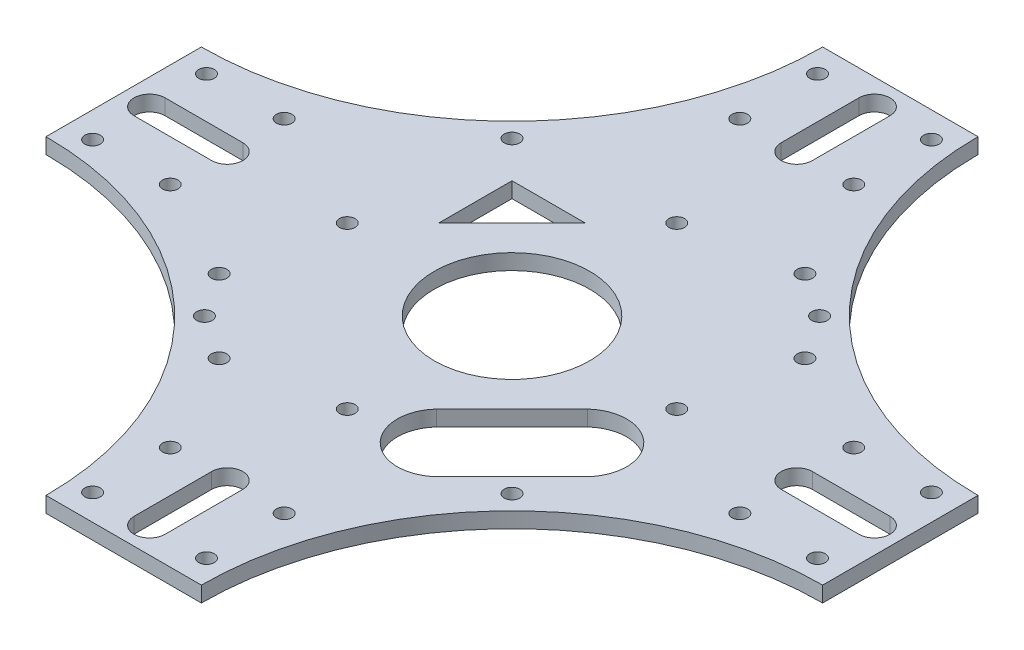
from build123d import *

# Parameters (mm, degrees)
SKETCH_1_R           = 1.25
EXTRUDE_1_DEPTH      = 3
SKETCH_2_R           = 1.5
CUT_EXTRUDE_1_DEPTH  = 3
CUT_EXTRUDE_2_DEPTH  = 3
CUT_EXTRUDE_3_DEPTH  = 3
CUT_EXTRUDE_4_DEPTH  = 10
SKETCH_6_R           = 1.5
CUT_EXTRUDE_5_DEPTH  = 10
SKETCH_7_R           = 1.5
CUT_EXTRUDE_8_DEPTH  = 10
SKETCH_8_R           = 1.5
CUT_EXTRUDE_9_DEPTH  = 10
SKETCH_9_R           = 15
CUT_EXTRUDE_10_DEPTH = 10
SKETCH_10_R          = 1.5
CUT_EXTRUDE_11_DEPTH = 10
CUT_EXTRUDE_12_DEPTH = 10


with BuildPart() as part:
    # 草图1 → 凸台-拉伸1 (new body)
    # profile 1 of 4: a face of its own
    with BuildSketch(Plane(origin=(0, 0, 0), x_dir=(1, 0, 0), z_dir=(0, 1, 0))):
        with BuildLine():
            ThreePointArc((75, -15), (32.573593129, -32.573593129), (15, -75))
            Line((15, -75), (0, -75))
            Line((0, -75), (0, 0))
            Line((0, 0), (75, 0))
            Line((75, 0), (75, -15))
        make_face()
        with Locations(Location((11, -70, 0), (0, 0, 270))):
            Circle(SKETCH_1_R, mode=Mode.SUBTRACT)
        with Locations(Location((70, -11, 0), (0, 0, 270))):
            Circle(SKETCH_1_R, mode=Mode.SUBTRACT)
    # profile 2 of 4: a face of its own
    with BuildSketch(Plane(origin=(0, 0, 0), x_dir=(1, 0, 0), z_dir=(0, 1, 0))):
        with BuildLine():
            ThreePointArc((-15, -75), (-32.573593129, -32.573593129), (-75, -15))
            Line((-75, -15), (-75, 0))
            Line((-75, 0), (0, 0))
            Line((0, 0), (0, -75))
            Line((0, -75), (-15, -75))
        make_face()
        with Locations(Location((-70, -11, 0), (0, 0, 270))):
            Circle(SKETCH_1_R, mode=Mode.SUBTRACT)
        with Locations(Location((-11, -70, 0), (0, 0, 270))):
            Circle(SKETCH_1_R, mode=Mode.SUBTRACT)
    # profile 3 of 4: a face of its own
    with BuildSketch(Plane(origin=(0, 0, 0), x_dir=(1, 0, 0), z_dir=(0, 1, 0))):
        with BuildLine():
            ThreePointArc((-75, 15), (-32.573593129, 32.573593129), (-15, 75))
            Line((-15, 75), (0, 75))
            Line((0, 75), (0, 0))
            Line((0, 0), (-75, 0))
            Line((-75, 0), (-75, 15))
        make_face()
        with Locations(Location((-11, 70, 0), (0, 0, 270))):
            Circle(SKETCH_1_R, mode=Mode.SUBTRACT)
        with Locations(Location((-70, 11, 0), (0, 0, 270))):
            Circle(SKETCH_1_R, mode=Mode.SUBTRACT)
    # profile 4 of 4: a face of its own
    with BuildSketch(Plane(origin=(0, 0, 0), x_dir=(1, 0, 0), z_dir=(0, 1, 0))):
        with BuildLine():
            ThreePointArc((15, 75), (32.573593129, 32.573593129), (75, 15))
            Line((75, 15), (75, 0))
            Line((75, 0), (0, 0))
            Line((0, 0), (0, 75))
            Line((0, 75), (15, 75))
        make_face()
        with Locations(Location((70, 11, 0), (0, 0, 270))):
            Circle(SKETCH_1_R, mode=Mode.SUBTRACT)
        with Locations(Location((11, 70, 0), (0, 0, 270))):
            Circle(SKETCH_1_R, mode=Mode.SUBTRACT)
    extrude(amount=EXTRUDE_1_DEPTH)

    # 草图2 → 切除-拉伸1 (cut)
    with BuildSketch(Plane.XZ):
        with Locations(Location((0.353553391, -31.466251763, 0), (0, 0, 270))):
            Circle(SKETCH_2_R)
        with Locations(Location((31.466251763, -0.353553391, 0), (0, 0, 270))):
            Circle(SKETCH_2_R)
        with Locations(Location((-0.353553391, 31.466251763, 0), (0, 0, 90))):
            Circle(SKETCH_2_R)
        with Locations(Location((-31.466251763, 0.353553391, 0), (0, 0, 90))):
            Circle(SKETCH_2_R)
    extrude(amount=-CUT_EXTRUDE_1_DEPTH, mode=Mode.SUBTRACT)

    # 草图3 → 切除-拉伸2 (cut)
    with BuildSketch(Plane(origin=(0, 3, 0), x_dir=(1, 0, 0), z_dir=(0, 1, 0))):
        Polygon((-15.556349186, 15.556349186), (-12.02081528, 19.091883092), (-22.627416998, 22.627416998), align=None)
        Polygon((-19.091883092, 12.02081528), (-15.556349186, 15.556349186), (-22.627416998, 22.627416998), align=None)
    extrude(amount=-CUT_EXTRUDE_2_DEPTH, mode=Mode.SUBTRACT)

    # 草图4 → 切除-拉伸3 (cut)
    with BuildSketch(Plane(origin=(0, 3, 0), x_dir=(1, 0, 0), z_dir=(0, 1, 0))):
        with BuildLine():
            ThreePointArc((33.944668714, -19.80253309), (34.043922781, -8.582763971), (22.827665534, -8.285032838))
            Line((22.827665534, -8.285032838), (15.556349186, -15.556349186))
            Line((15.556349186, -15.556349186), (8.285032838, -22.827665534))
            ThreePointArc((8.285032838, -22.827665534), (8.582763971, -34.043922781), (19.80253309, -33.944668714))
            Line((19.80253309, -33.944668714), (33.944668714, -19.80253309))
        make_face()
    extrude(amount=-CUT_EXTRUDE_3_DEPTH, mode=Mode.SUBTRACT)

    # 草图5 → 切除-拉伸4 (cut)
    with BuildSketch(Plane(origin=(0, 3, 0), x_dir=(1, 0, 0), z_dir=(0, 1, 0))):
        Polygon((-22.627416998, 8.485281374), (-22.627416998, 22.627416998), (-19.091883092, 12.02081528), align=None)
        Polygon((-12.02081528, 19.091883092), (-22.627416998, 22.627416998), (-8.485281374, 22.627416998), align=None)
    extrude(amount=-CUT_EXTRUDE_4_DEPTH, mode=Mode.SUBTRACT)

    # 草图6 → 切除-拉伸5 (cut)
    with BuildSketch(Plane(origin=(0, 3, 0), x_dir=(1, 0, 0), z_dir=(0, 1, 0))):
        with Locations(Location((-35.355339059, -21.213203436, 0), (0, 0, 270))):
            Circle(SKETCH_6_R)
        with Locations(Location((-21.213203436, -35.355339059, 0), (0, 0, 270))):
            Circle(SKETCH_6_R)
        with Locations(Location((35.355339059, 21.213203436, 0), (0, 0, 270))):
            Circle(SKETCH_6_R)
        with Locations(Location((21.213203436, 35.355339059, 0), (0, 0, 270))):
            Circle(SKETCH_6_R)
    extrude(amount=-CUT_EXTRUDE_5_DEPTH, mode=Mode.SUBTRACT)

    # 草图7 → 切除-拉伸8 (cut)
    with BuildSketch(Plane(origin=(0, 3, 0), x_dir=(1, 0, 0), z_dir=(0, 1, 0))):
        with Locations(Location((-29.69848481, 29.69848481, 0), (0, 0, 270))):
            Circle(SKETCH_7_R)
        with Locations(Location((29.69848481, 29.69848481, 0), (0, 0, 270))):
            Circle(SKETCH_7_R)
        with Locations(Location((29.69848481, -29.69848481, 0), (0, 0, 270))):
            Circle(SKETCH_7_R)
        with Locations(Location((-29.69848481, -29.69848481, 0), (0, 0, 270))):
            Circle(SKETCH_7_R)
    extrude(amount=-CUT_EXTRUDE_8_DEPTH, mode=Mode.SUBTRACT)

    # 草图8 → 切除-拉伸9 (cut)
    with BuildSketch(Plane(origin=(0, 3, 0), x_dir=(1, 0, 0), z_dir=(0, 1, 0))):
        with Locations(Location((-11, 55, 0), (0, 0, 270))):
            Circle(SKETCH_8_R)
        with Locations(Location((11, 55, 0), (0, 0, 270))):
            Circle(SKETCH_8_R)
        with Locations(Location((55, 11, 0), (0, 0, 270))):
            Circle(SKETCH_8_R)
        with Locations(Location((55, -11, 0), (0, 0, 270))):
            Circle(SKETCH_8_R)
        with Locations(Location((11, -55, 0), (0, 0, 270))):
            Circle(SKETCH_8_R)
        with Locations(Location((-11, -55, 0), (0, 0, 270))):
            Circle(SKETCH_8_R)
        with Locations(Location((-55, -11, 0), (0, 0, 270))):
            Circle(SKETCH_8_R)
        with Locations(Location((-55, 11, 0), (0, 0, 270))):
            Circle(SKETCH_8_R)
    extrude(amount=-CUT_EXTRUDE_9_DEPTH, mode=Mode.SUBTRACT)

    # 草图9 → 切除-拉伸10 (cut)
    with BuildSketch(Plane(origin=(0, 3, 0), x_dir=(1, 0, 0), z_dir=(0, 1, 0))):
        with Locations(Location((0, 0, 0), (0, 0, 270))):
            Circle(SKETCH_9_R)
    extrude(amount=-CUT_EXTRUDE_10_DEPTH, mode=Mode.SUBTRACT)

    # 草图10 → 切除-拉伸11 (cut)
    with BuildSketch(Plane(origin=(0, 3, 0), x_dir=(1, 0, 0), z_dir=(0, 1, 0))):
        with Locations(Location((11, 70, 0), (0, 0, 270))):
            Circle(SKETCH_10_R)
        with Locations(Location((-11, 70, 0), (0, 0, 270))):
            Circle(SKETCH_10_R)
        with Locations(Location((70, 11, 0), (0, 0, 270))):
            Circle(SKETCH_10_R)
        with Locations(Location((70, -11, 0), (0, 0, 270))):
            Circle(SKETCH_10_R)
        with Locations(Location((11, -70, 0), (0, 0, 270))):
            Circle(SKETCH_10_R)
        with Locations(Location((-11, -70, 0), (0, 0, 270))):
            Circle(SKETCH_10_R)
        with Locations(Location((-70, -11, 0), (0, 0, 270))):
            Circle(SKETCH_10_R)
        with Locations(Location((-70, 11, 0), (0, 0, 270))):
            Circle(SKETCH_10_R)
    extrude(amount=-CUT_EXTRUDE_11_DEPTH, mode=Mode.SUBTRACT)

    # 草图11 → 切除-拉伸12 (cut)
    with BuildSketch(Plane(origin=(0, 3, 0), x_dir=(1, 0, 0), z_dir=(0, 1, 0))):
        with BuildLine():
            Line((3, 70), (3, 55))
            ThreePointArc((3, 55), (0, 52), (-3, 55))
            Line((-3, 55), (-3, 70))
            ThreePointArc((-3, 70), (0, 73), (3, 70))
        make_face()
        with BuildLine():
            Line((70, -3), (55, -3))
            ThreePointArc((55, -3), (52, 0), (55, 3))
            Line((55, 3), (70, 3))
            ThreePointArc((70, 3), (73, 0), (70, -3))
        make_face()
        with BuildLine():
            Line((-3, -70), (-3, -55))
            ThreePointArc((-3, -55), (0, -52), (3, -55))
            Line((3, -55), (3, -70))
            ThreePointArc((3, -70), (0, -73), (-3, -70))
        make_face()
        with BuildLine():
            Line((-70, 3), (-55, 3))
            ThreePointArc((-55, 3), (-52, 0), (-55, -3))
            Line((-55, -3), (-70, -3))
            ThreePointArc((-70, -3), (-73, 0), (-70, 3))
        make_face()
    extrude(amount=-CUT_EXTRUDE_12_DEPTH, mode=Mode.SUBTRACT)


solid = part.part
